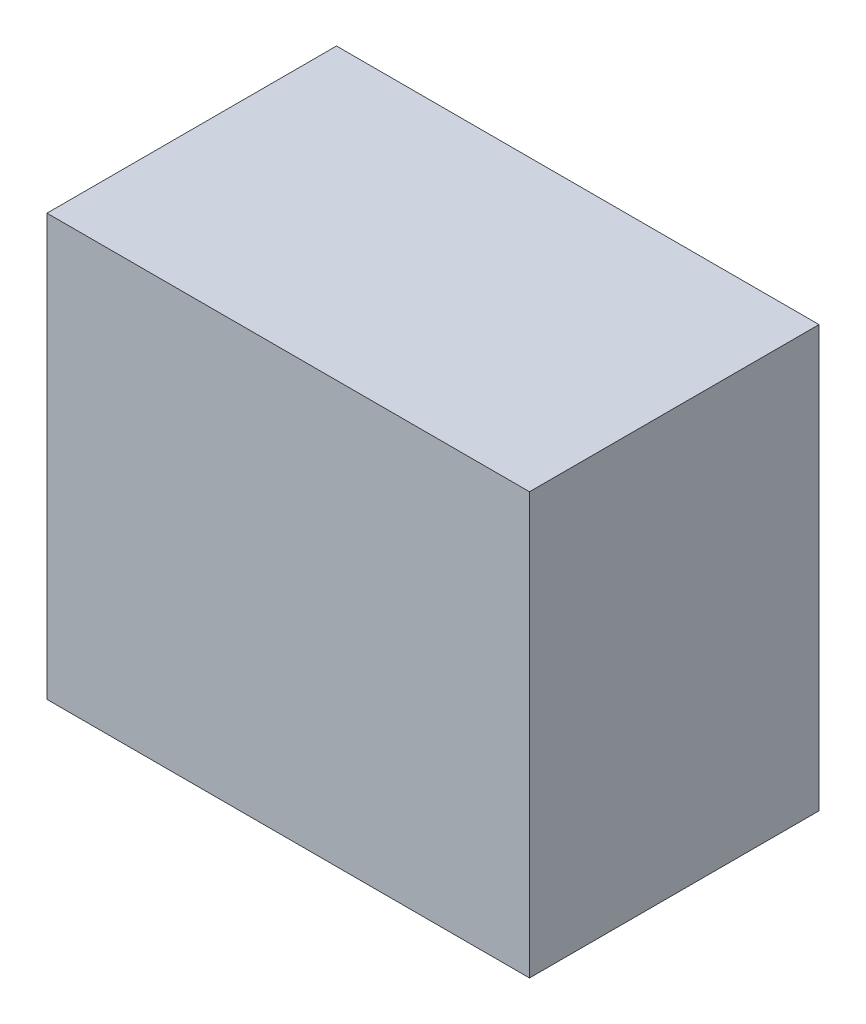
from build123d import *

# Parameters (mm, degrees)
SKETCH1_W           = 55
SKETCH1_H           = 33
BOSS_EXTRUDE1_DEPTH = 48
CUT_EXTRUDE1_DEPTH  = 51.5


with BuildPart() as part:
    # Sketch1 → Boss-Extrude1 (new body)
    with BuildSketch(Plane(origin=(0, 0, 0), x_dir=(1, 0, 0), z_dir=(0, 1, 0))):
        Rectangle(SKETCH1_W, SKETCH1_H)
    extrude(amount=BOSS_EXTRUDE1_DEPTH)

    # Sketch2 → Cut-Extrude1 (cut)
    with BuildSketch(Plane.ZY.offset(25.75)):
        with BuildLine():
            Line((14.75565, 32), (14.75565, 16))
            ThreePointArc((14.75565, 16), (0, 1.24435), (-14.75565, 16))
            Line((-14.75565, 16), (-14.75565, 32))
            ThreePointArc((-14.75565, 32), (0, 46.75565), (14.75565, 32))
        make_face()
    extrude(amount=-CUT_EXTRUDE1_DEPTH, mode=Mode.SUBTRACT)


solid = part.part
